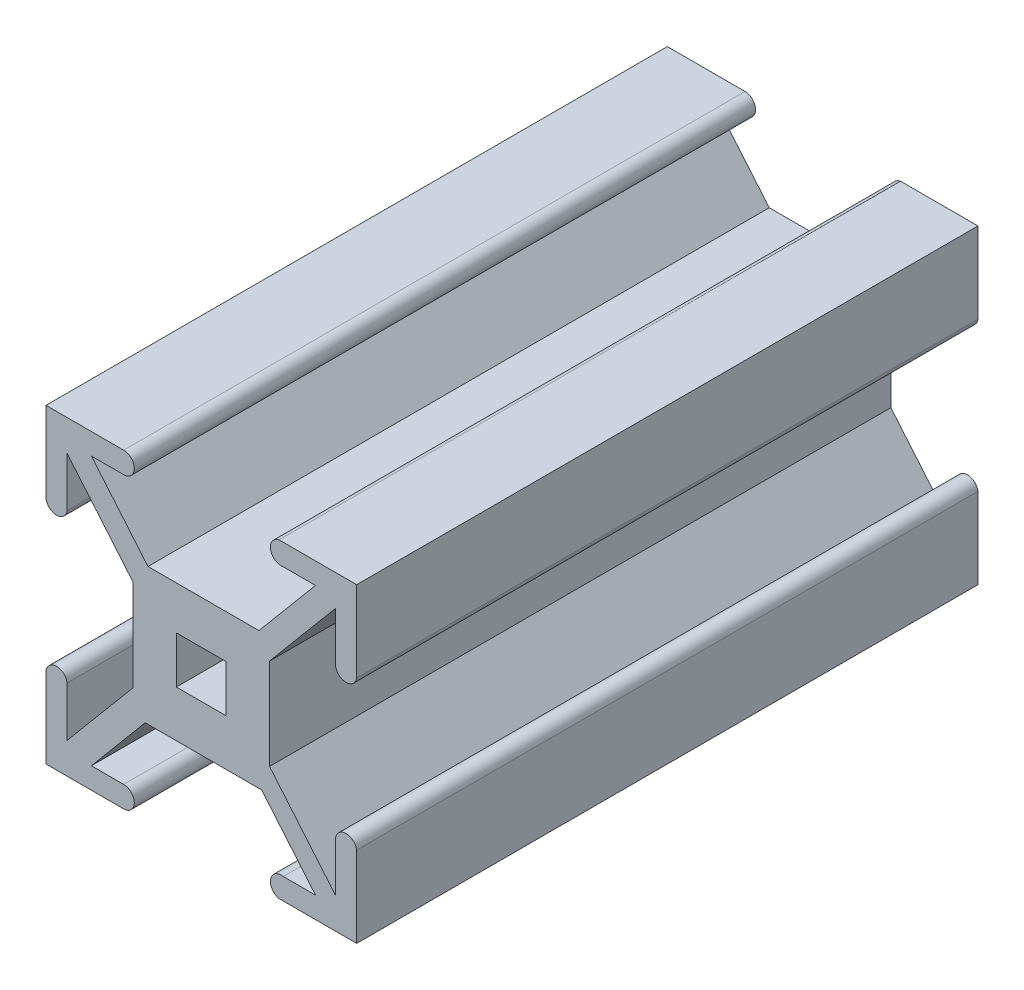
from build123d import *

# Parameters (mm, degrees)
SKETCH1_W           = 50
SKETCH1_H           = 50
BOSS_EXTRUDE1_DEPTH = 100
SKETCH2_W           = 18
SKETCH2_H           = 18
CUT_EXTRUDE2_DEPTH  = 287
SKETCH3_OUTSIDE_W   = 76.494
SKETCH3_OUTSIDE_H   = 76.494
CUT_EXTRUDE5_DEPTH  = 287
SKETCH4_W           = 18
SKETCH4_H           = 18
BOSS_EXTRUDE2_DEPTH = 100
SKETCH5_W           = 8
SKETCH5_H           = 7.553245746
CUT_EXTRUDE6_DEPTH  = 250


with BuildPart() as part:
    # Sketch1 → Boss-Extrude1 (new body)
    with BuildSketch(Plane.XY):
        with Locations((3.9408867, 0)):
            Rectangle(SKETCH1_W, SKETCH1_H)
    extrude(amount=BOSS_EXTRUDE1_DEPTH)

    # Sketch2 → Cut-Extrude2 (cut)
    with BuildSketch(Plane(origin=(0, 0, 0), x_dir=(-1, 0, 0), z_dir=(0, 0, -1))):
        with Locations((-3.9408867, 0)):
            Rectangle(SKETCH2_W, SKETCH2_H)
    extrude(amount=-CUT_EXTRUDE2_DEPTH, mode=Mode.SUBTRACT)

    # Sketch3 outside → Cut-Extrude5 (cut)
    with BuildSketch(Plane(origin=(0, 0, 0), x_dir=(-1, 0, 0), z_dir=(0, 0, -1))):
        with Locations((-3.941, 0)):
            Rectangle(SKETCH3_OUTSIDE_W, SKETCH3_OUTSIDE_H)
        with BuildLine():
            Line((-22.316271067, 21.584230763), (-17.116271067, 21.584230763))
            ThreePointArc((-17.116271067, 21.584230763), (-15.082817857, 22.96654679), (-16.465133883, 25))
            Line((-16.465133883, 25), (-28.9408867, 25))
            Line((-28.9408867, 25), (-28.9408867, 12.5))
            ThreePointArc((-28.9408867, 12.5), (-27.489165976, 10.551720724), (-25.5408867, 12.003441448))
            Line((-25.5408867, 12.003441448), (-25.5408867, 20.003441448))
            Line((-25.5408867, 20.003441448), (-18.539469589, 11.659477453))
            Line((-18.539469589, 11.659477453), (-14.917465737, 7.34294135))
            Line((-14.917465737, 7.34294135), (-14.917465737, -7.34294135))
            Line((-14.917465737, -7.34294135), (-18.539469589, -11.659477453))
            Line((-18.539469589, -11.659477453), (-25.5408867, -20.003441448))
            Line((-25.5408867, -20.003441448), (-25.5408867, -12.003441448))
            ThreePointArc((-25.5408867, -12.003441448), (-27.489165976, -10.551720724), (-28.9408867, -12.5))
            Line((-28.9408867, -12.5), (-28.9408867, -25))
            Line((-28.9408867, -25), (-16.465133883, -25))
            ThreePointArc((-16.465133883, -25), (-15.082817857, -22.96654679), (-17.116271067, -21.584230763))
            Line((-17.116271067, -21.584230763), (-22.316271067, -21.584230763))
            Line((-22.316271067, -21.584230763), (-17.28167328, -15.584230763))
            Line((-17.28167328, -15.584230763), (-13.653142176, -11.259915785))
            Line((-13.653142176, -11.259915785), (5.089795616, -11.259915785))
            Line((5.089795616, -11.259915785), (8.71832672, -15.584230763))
            Line((8.71832672, -15.584230763), (13.752924507, -21.584230763))
            Line((13.752924507, -21.584230763), (8.5591133, -21.584230763))
            ThreePointArc((8.5591133, -21.584230763), (6.851228682, -23.292115382), (8.5591133, -25))
            Line((8.5591133, -25), (21.0591133, -25))
            Line((21.0591133, -25), (21.0591133, -12.5))
            ThreePointArc((21.0591133, -12.5), (19.607392577, -10.551720724), (17.6591133, -12.003441448))
            Line((17.6591133, -12.003441448), (17.6591133, -20.003441448))
            Line((17.6591133, -20.003441448), (10.65769619, -11.659477453))
            Line((10.65769619, -11.659477453), (7.035692338, -7.34294135))
            Line((7.035692338, -7.34294135), (7.035692338, 7.34294135))
            Line((7.035692338, 7.34294135), (10.65769619, 11.659477453))
            Line((10.65769619, 11.659477453), (17.6591133, 20.003441448))
            Line((17.6591133, 20.003441448), (17.6591133, 12.003441448))
            ThreePointArc((17.6591133, 12.003441448), (19.607392577, 10.551720724), (21.0591133, 12.5))
            Line((21.0591133, 12.5), (21.0591133, 25))
            Line((21.0591133, 25), (8.5591133, 25))
            ThreePointArc((8.5591133, 25), (6.851228682, 23.292115382), (8.5591133, 21.584230763))
            Line((8.5591133, 21.584230763), (13.752924507, 21.584230763))
            Line((13.752924507, 21.584230763), (8.71832672, 15.584230763))
            Line((8.71832672, 15.584230763), (4.653605138, 10.740084215))
            Line((4.653605138, 10.740084215), (-13.216951698, 10.740084215))
            Line((-13.216951698, 10.740084215), (-17.28167328, 15.584230763))
            Line((-17.28167328, 15.584230763), (-22.316271067, 21.584230763))
        make_face(mode=Mode.SUBTRACT)
    extrude(amount=-CUT_EXTRUDE5_DEPTH, mode=Mode.SUBTRACT)

    # Sketch4 → Boss-Extrude2 (add)
    with BuildSketch(Plane(origin=(0, 0, 0), x_dir=(-1, 0, 0), z_dir=(0, 0, -1))):
        with Locations((-3.9408867, 0)):
            Rectangle(SKETCH4_W, SKETCH4_H)
    extrude(amount=-BOSS_EXTRUDE2_DEPTH)

    # Sketch5 → Cut-Extrude6 (cut)
    with BuildSketch(Plane(origin=(0, 0, 0), x_dir=(-1, 0, 0), z_dir=(0, 0, -1))):
        with Locations((-3.917465737, 0)):
            Rectangle(SKETCH5_W, SKETCH5_H)
    extrude(amount=-CUT_EXTRUDE6_DEPTH, mode=Mode.SUBTRACT)


solid = part.part
